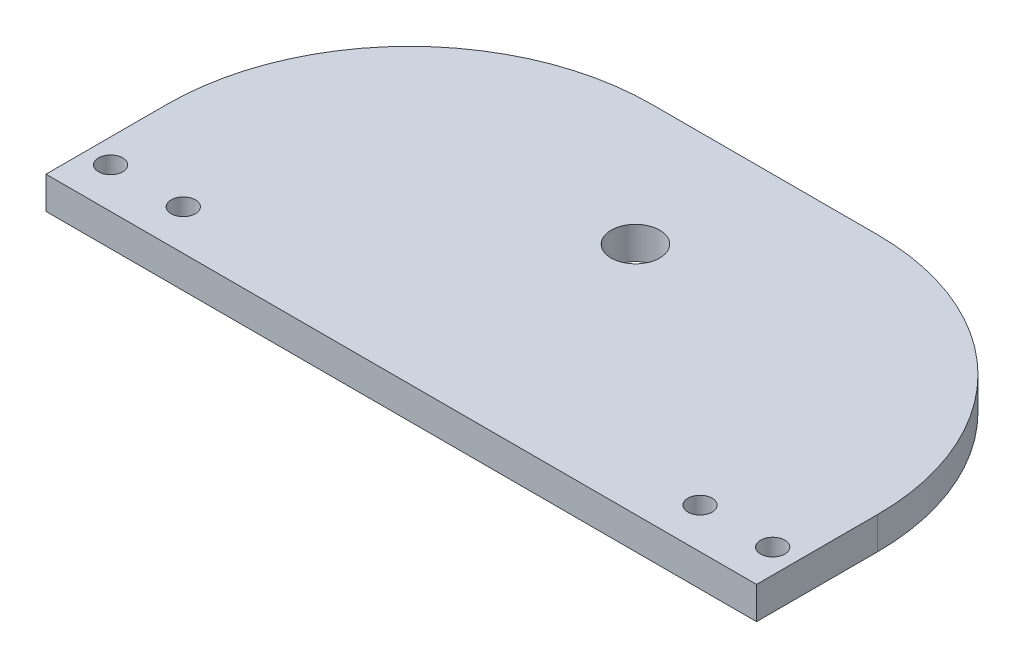
from build123d import *

# Parameters (mm, degrees)
SKETCH_1_W          = 88
SKETCH_1_H          = 45
EXTRUDE_1_DEPTH     = 4
SKETCH_2_R          = 3
CUT_EXTRUDE_1_DEPTH = 4
SKETCH_3_R          = 1.5
CUT_EXTRUDE_2_DEPTH = 50.580742229
FILLET_1_R          = 30


with BuildPart() as part:
    # 草图1 → 凸台-拉伸1 (new body)
    with BuildSketch(Plane(origin=(0, 0, 0), x_dir=(1, 0, 0), z_dir=(0, 1, 0))):
        Rectangle(SKETCH_1_W, SKETCH_1_H)
    extrude(amount=EXTRUDE_1_DEPTH)

    # 草图2 → 切除-拉伸1 (cut)
    with BuildSketch(Plane(origin=(0, 4, 0), x_dir=(1, 0, 0), z_dir=(0, 1, 0))):
        with Locations(Location((0, 6.5, 0), (0, 0, 270))):
            Circle(SKETCH_2_R)
    extrude(amount=-CUT_EXTRUDE_1_DEPTH, mode=Mode.SUBTRACT)

    # 草图3 → 切除-拉伸2 (cut, through all)
    with BuildSketch(Plane(origin=(0, 4, 0), x_dir=(1, 0, 0), z_dir=(0, 1, 0))):
        with Locations(Location((-41, -17.5, 0), (0, 0, 270))):
            Circle(SKETCH_3_R)
        with Locations(Location((-32, -17.5, 0), (0, 0, 90))):
            Circle(SKETCH_3_R)
        with Locations(Location((32, -17.5, 0), (0, 0, 270))):
            Circle(SKETCH_3_R)
        with Locations(Location((41, -17.5, 0), (0, 0, 90))):
            Circle(SKETCH_3_R)
    extrude(amount=-CUT_EXTRUDE_2_DEPTH, mode=Mode.SUBTRACT)

    # 圆角1
    fillet_1_edges = [part.edges().sort_by_distance(p)[0] for p in [
        (-44, 2, -22.5),
        (44, 2, -22.5),
    ]]
    fillet(fillet_1_edges, radius=FILLET_1_R)


solid = part.part
